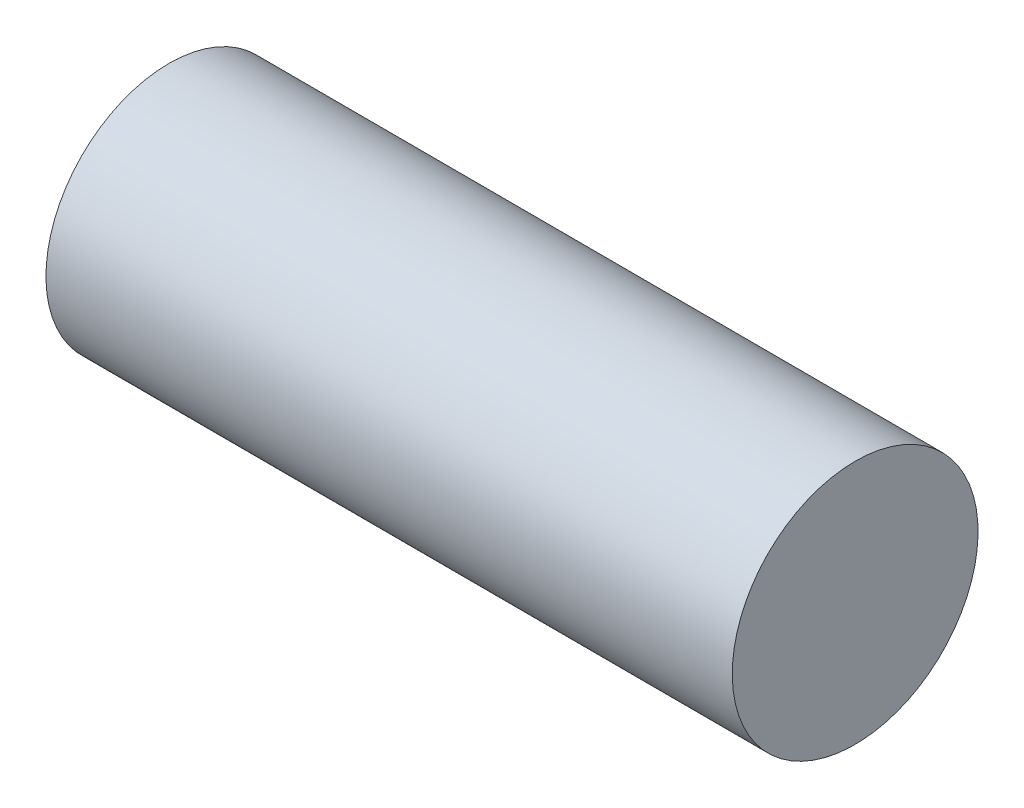
from build123d import *

# Parameters (mm, degrees)
SWEEP1_PROFILE_R = 4.699


with BuildPart() as part:
    # Sweep1: sweep along a curve in space
    with BuildLine() as sweep1_path:
        Line((-13.558042445, 200.895063597, 163.321797228), (12.685805764, 200.845332568, 163.321797176))
    # Sweep1 profile (on start of the path) → Sweep1 (sweep)
    with BuildSketch(Plane(origin=(-13.558042445, 200.895063597, 163.321797228), x_dir=(0.0018949561087567204, 0.9999982045690612, 0), z_dir=(0.9999982045690612, -0.0018949561087567204, -1.977783720499839e-09))):
        Circle(SWEEP1_PROFILE_R)
    sweep(path=sweep1_path.line)


solid = part.part
